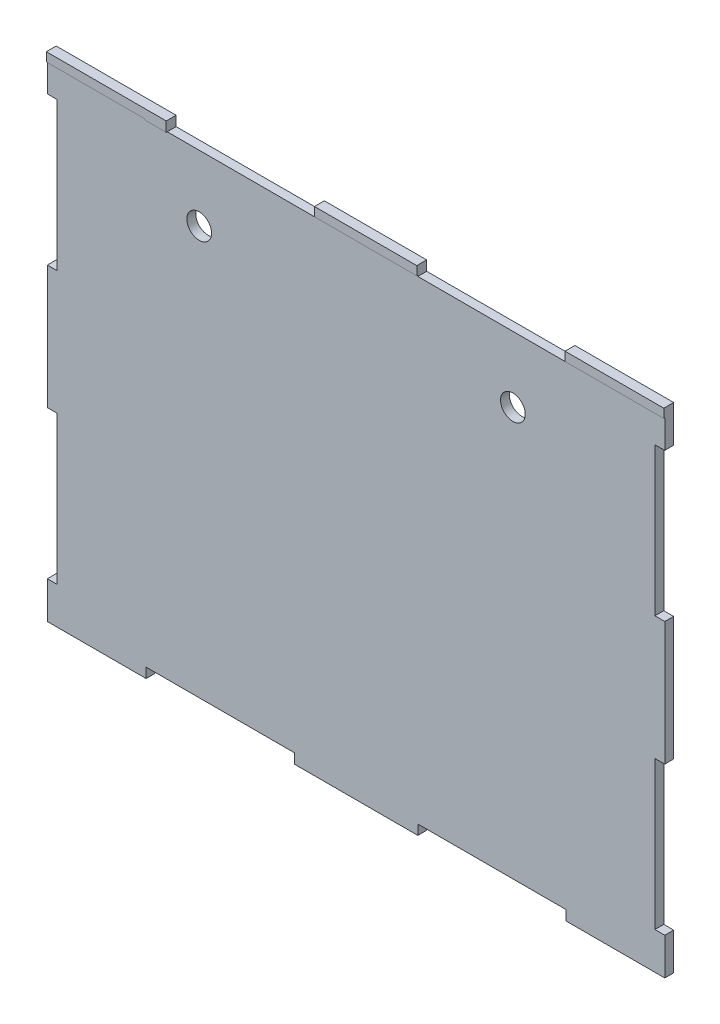
from build123d import *

# Parameters (mm, degrees)
SKETCH_1_W          = 250
SKETCH_1_H          = 200
EXTRUDE_1_DEPTH     = 3.6
SKETCH_2_W          = 4
SKETCH_2_H          = 60
CUT_EXTRUDE_1_DEPTH = 10
SKETCH_3_W          = 60
SKETCH_3_H          = 4
CUT_EXTRUDE_2_DEPTH = 10
SKETCH_4_R          = 5
CUT_EXTRUDE_3_DEPTH = 10
SKETCH_5_W          = 250
SKETCH_5_H          = 3.6
EXTRUDE_2_DEPTH     = 4
SKETCH_6_W          = 60
SKETCH_6_H          = 4
CUT_EXTRUDE_4_DEPTH = 161.128073741
SKETCH_7_W          = 4
SKETCH_7_H          = 3.6
EXTRUDE_3_DEPTH     = 8.5
SKETCH_8_W          = 68.538276959
SKETCH_8_H          = 3.6
CUT_EXTRUDE_5_DEPTH = 8.5
SKETCH_9_W          = 8.538276959
SKETCH_9_H          = 4
EXTRUDE_4_DEPTH     = 4
SKETCH_10_W         = 60
SKETCH_10_H         = 4
CUT_EXTRUDE_6_DEPTH = 8.5


with BuildPart() as part:
    # 草图1 → 凸台-拉伸1 (new body)
    with BuildSketch(Plane.XY):
        Rectangle(SKETCH_1_W, SKETCH_1_H)
    extrude(amount=EXTRUDE_1_DEPTH)

    # 草图2 → 切除-拉伸1 (cut)
    with BuildSketch(Plane.XY.offset(3.6)):
        with Locations((-123, 55)):
            Rectangle(SKETCH_2_W, SKETCH_2_H)
        with Locations((123, 55)):
            Rectangle(SKETCH_2_W, SKETCH_2_H)
        with Locations((-123, -55)):
            Rectangle(SKETCH_2_W, SKETCH_2_H)
        with Locations((123, -55)):
            Rectangle(SKETCH_2_W, SKETCH_2_H)
    extrude(amount=-CUT_EXTRUDE_1_DEPTH, mode=Mode.SUBTRACT)

    # 草图3 → 切除-拉伸2 (cut)
    with BuildSketch(Plane.XY.offset(3.6)):
        with Locations((-55, -98)):
            Rectangle(SKETCH_3_W, SKETCH_3_H)
        with Locations((55, -98)):
            Rectangle(SKETCH_3_W, SKETCH_3_H)
        with Locations((55, 98)):
            Rectangle(SKETCH_3_W, SKETCH_3_H)
        with Locations((-55, 98)):
            Rectangle(SKETCH_3_W, SKETCH_3_H)
    extrude(amount=-CUT_EXTRUDE_2_DEPTH, mode=Mode.SUBTRACT)

    # 草图4 → 切除-拉伸3 (cut)
    with BuildSketch(Plane(origin=(0, 0, 0), x_dir=(-1, 0, 0), z_dir=(0, 0, -1))):
        with Locations((-63.5, 69.4)):
            Circle(SKETCH_4_R)
        with Locations((63.5, 69.4)):
            Circle(SKETCH_4_R)
    extrude(amount=-CUT_EXTRUDE_3_DEPTH, mode=Mode.SUBTRACT)

    # 草图5 → 凸台-拉伸2 (add)
    with BuildSketch(Plane(origin=(0, 0, 0), x_dir=(-1, 0, 0), z_dir=(0, 0, -1))):
        with Locations((0, 98.2)):
            Rectangle(SKETCH_5_W, SKETCH_5_H)
    extrude(amount=-EXTRUDE_2_DEPTH)

    # 草图6 → 切除-拉伸4 (cut, through all)
    with BuildSketch(Plane(origin=(0, 0, 0), x_dir=(-1, 0, 0), z_dir=(0, 0, -1))):
        with Locations((-55, 98)):
            Rectangle(SKETCH_6_W, SKETCH_6_H)
        with Locations((55, 98)):
            Rectangle(SKETCH_6_W, SKETCH_6_H)
    extrude(amount=-CUT_EXTRUDE_4_DEPTH, mode=Mode.SUBTRACT)

    # 草图7 → 凸台-拉伸3 (add)
    with BuildSketch(Plane(origin=(-85, 0, 0), x_dir=(0, 0, -1), z_dir=(1, 0, 0))):
        with Locations((-2, 98.2)):
            Rectangle(SKETCH_7_W, SKETCH_7_H)
    extrude(amount=EXTRUDE_3_DEPTH)

    # 草图8 → 切除-拉伸5 (cut)
    with BuildSketch(Plane(origin=(0, 0, 0), x_dir=(-1, 0, 0), z_dir=(0, 0, -1))):
        with Locations((50.717618655, 98.2)):
            Rectangle(SKETCH_8_W, SKETCH_8_H)
    extrude(amount=-CUT_EXTRUDE_5_DEPTH, mode=Mode.SUBTRACT)

    # 草图9 → 凸台-拉伸4 (add)
    with BuildSketch(Plane(origin=(0, 0, 0), x_dir=(-1, 0, 0), z_dir=(0, 0, -1))):
        with Locations((80.717618655, 98)):
            Rectangle(SKETCH_9_W, SKETCH_9_H)
    extrude(amount=-EXTRUDE_4_DEPTH)

    # 草图10 → 切除-拉伸6 (cut)
    with BuildSketch(Plane(origin=(0, 0, 0), x_dir=(-1, 0, 0), z_dir=(0, 0, -1))):
        with Locations((46.448480175, 98)):
            Rectangle(SKETCH_10_W, SKETCH_10_H)
    extrude(amount=-CUT_EXTRUDE_6_DEPTH, mode=Mode.SUBTRACT)


solid = part.part
